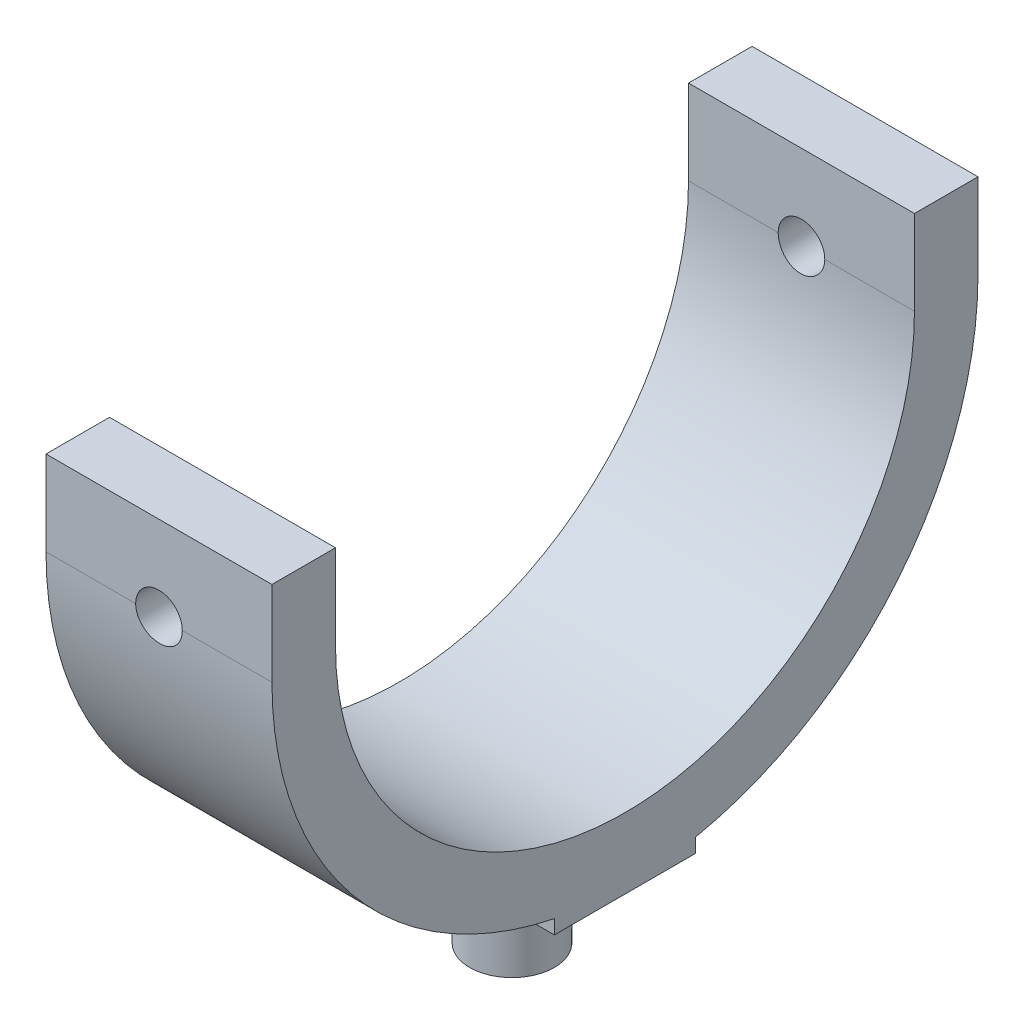
from build123d import *

# Parameters (mm, degrees)
BOSS_EXTRUDE1_DEPTH = 16
SKETCH4_R           = 3
BOSS_EXTRUDE2_DEPTH = 7
SKETCH5_R           = 1.65
CUT_EXTRUDE1_DEPTH  = 62.740735004


with BuildPart() as part:
    # Sketch1 → Boss-Extrude1 (new body)
    with BuildSketch(Plane(origin=(0, 0, 0), x_dir=(0, 0, -1), z_dir=(1, 0, 0))):
        with BuildLine():
            Line((-5, -24.494897428), (-5, -25.494897428))
            Line((-5, -25.494897428), (5, -25.494897428))
            Line((5, -25.494897428), (5, -24.494897428))
            ThreePointArc((5, -24.494897428), (19.364916731, -15.811388301), (25, 0))
            Line((25, 0), (25, 6))
            Line((25, 6), (20.5, 6))
            Line((20.5, 6), (20.5, 0))
            ThreePointArc((20.5, 0), (0, -20.5), (-20.5, 0))
            Line((-20.5, 0), (-20.5, 6))
            Line((-20.5, 6), (-25, 6))
            Line((-25, 6), (-25, 0))
            ThreePointArc((-25, 0), (-19.364916731, -15.811388301), (-5, -24.494897428))
        make_face()
    extrude(amount=BOSS_EXTRUDE1_DEPTH)

    # Sketch4 → Boss-Extrude2 (add)
    with BuildSketch(Plane.XZ.offset(25.494897428)):
        with Locations(Location((8, 0, 0), (0, 0, 270))):
            Circle(SKETCH4_R)
    extrude(amount=BOSS_EXTRUDE2_DEPTH)

    # Sketch5 → Cut-Extrude1 (cut, through all)
    with BuildSketch(Plane(origin=(0, 0, -25), x_dir=(-1, 0, 0), z_dir=(0, 0, -1))):
        with Locations((-8, 0)):
            Circle(SKETCH5_R)
    extrude(amount=-CUT_EXTRUDE1_DEPTH, mode=Mode.SUBTRACT)


solid = part.part
